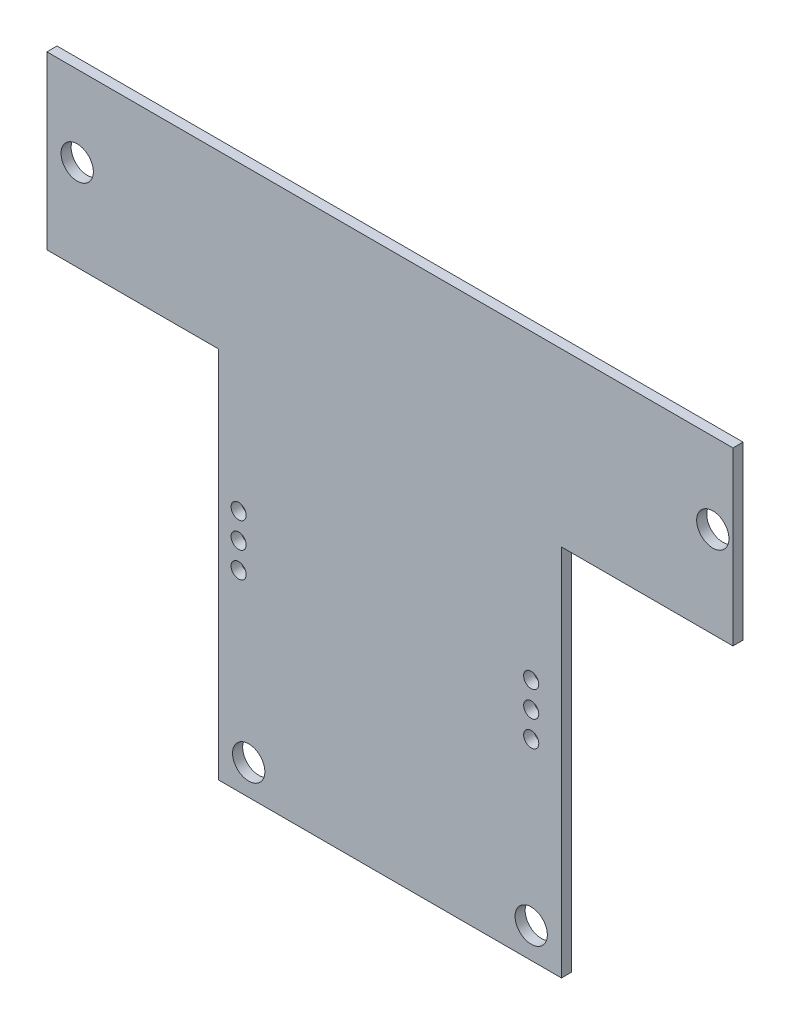
from build123d import *

# Parameters (mm, degrees)
IZIM1_R                     = 1.6
Y_KSEKLIK_EKSTR_ZYON1_DEPTH = 1
IZIM2_R                     = 0.75
KES_EKSTR_ZYON1_DEPTH       = 10


with BuildPart() as part:
    # Çizim1 → Yükseklik-Ekstrüzyon1 (new body)
    with BuildSketch(Plane.XY):
        Polygon((0, 0), (68, 0), (68, -17), (51, -17), (51, -54), (17, -54), (17, -17), (0, -17), align=None)
        with Locations((3, -8)):
            Circle(IZIM1_R, mode=Mode.SUBTRACT)
        with Locations((66, -8)):
            Circle(IZIM1_R, mode=Mode.SUBTRACT)
        with Locations((20, -51)):
            Circle(IZIM1_R, mode=Mode.SUBTRACT)
        with Locations((48, -51)):
            Circle(IZIM1_R, mode=Mode.SUBTRACT)
    extrude(amount=Y_KSEKLIK_EKSTR_ZYON1_DEPTH)

    # Çizim2 → Kes-Ekstrüzyon1 (cut)
    with BuildSketch(Plane.XY.offset(1)):
        with Locations((19, -35)):
            Circle(IZIM2_R)
        with Locations((19, -32.46)):
            Circle(IZIM2_R)
        with Locations((19, -29.92)):
            Circle(IZIM2_R)
        with Locations((48, -29.92)):
            Circle(IZIM2_R)
        with Locations((48, -32.46)):
            Circle(IZIM2_R)
        with Locations((48, -35)):
            Circle(IZIM2_R)
    extrude(amount=-KES_EKSTR_ZYON1_DEPTH, mode=Mode.SUBTRACT)


solid = part.part
